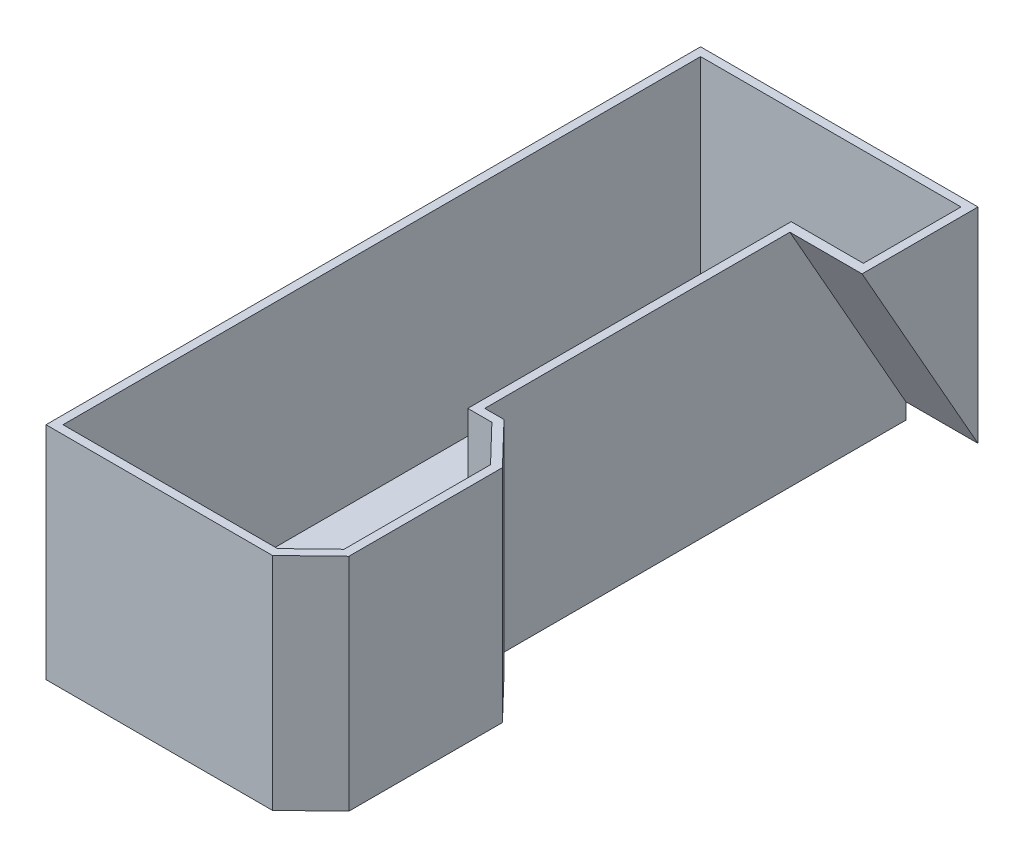
from build123d import *

# Parameters (mm, degrees)
SKETCH_1_W          = 290
SKETCH_1_H          = 925
EXTRUDE_1_DEPTH     = 12
EXTRUDE_3_DEPTH     = 12
EXTRUDE_4_DEPTH     = 300
CUT_EXTRUDE_1_DEPTH = 12
EXTRUDE_5_DEPTH     = 90
EXTRUDE_6_DEPTH     = 102
EXTRUDE_7_DEPTH     = 12


with BuildPart() as part:
    # 草图1 → 凸台-拉伸1 (new body)
    with BuildSketch(Plane(origin=(0, 0, 0), x_dir=(1, 0, 0), z_dir=(0, 1, 0))):
        with Locations((145, 462.5)):
            Rectangle(SKETCH_1_W, SKETCH_1_H)
    extrude(amount=EXTRUDE_1_DEPTH)

    # 草图3 → 凸台-拉伸3 (add)
    with BuildSketch(Plane(origin=(0, 12, 0), x_dir=(1, 0, 0), z_dir=(0, 1, 0))):
        Polygon((290, 330), (317.181818182, 330), (375, 270), (375, 53), (320, 0), (290, 0), align=None)
    extrude(amount=-EXTRUDE_3_DEPTH)

    # 草图4 → 凸台-拉伸4 (add)
    with BuildSketch(Plane(origin=(0, 12, 0), x_dir=(1, 0, 0), z_dir=(0, 1, 0))):
        Polygon((0, 925), (0, 0), (320, 0), (375, 53), (375, 270), (317.181818182, 330), (290, 330), (290, 925), align=None)
        Polygon((12, 913), (12, 12), (315.159103589, 12), (363, 58.101227451), (363, 265.159103589), (312.080590731, 318), (278, 318), (278, 913), align=None, mode=Mode.SUBTRACT)
    extrude(amount=EXTRUDE_4_DEPTH)

    # 草图5 → 切除-拉伸1 (cut)
    with BuildSketch(Plane(origin=(290, 0, 0), x_dir=(0, 0, -1), z_dir=(1, 0, 0))):
        Polygon((775, 312), (925, 47), (925, 312), align=None)
    extrude(amount=-CUT_EXTRUDE_1_DEPTH, mode=Mode.SUBTRACT)

    # 草图7 → 凸台-拉伸5 (add)
    with BuildSketch(Plane(origin=(290, 0, 0), x_dir=(0, 0, -1), z_dir=(1, 0, 0))):
        Polygon((775, 312), (925, 47), (925, 22.639376034), (761.210967567, 312), align=None)
    extrude(amount=EXTRUDE_5_DEPTH)

    # 草图8 → 凸台-拉伸6 (add)
    with BuildSketch(Plane(origin=(278, 0, 0), x_dir=(0, 0, -1), z_dir=(1, 0, 0))):
        Polygon((925, 312), (925, 47), (913, 68.2), (913, 312), align=None)
    extrude(amount=EXTRUDE_6_DEPTH)

    # 草图9 → 凸台-拉伸7 (add)
    with BuildSketch(Plane(origin=(380, 0, 0), x_dir=(0, 0, -1), z_dir=(1, 0, 0))):
        Polygon((761.210967567, 312), (925, 312), (925, 22.639376034), align=None)
    extrude(amount=EXTRUDE_7_DEPTH)


solid = part.part
